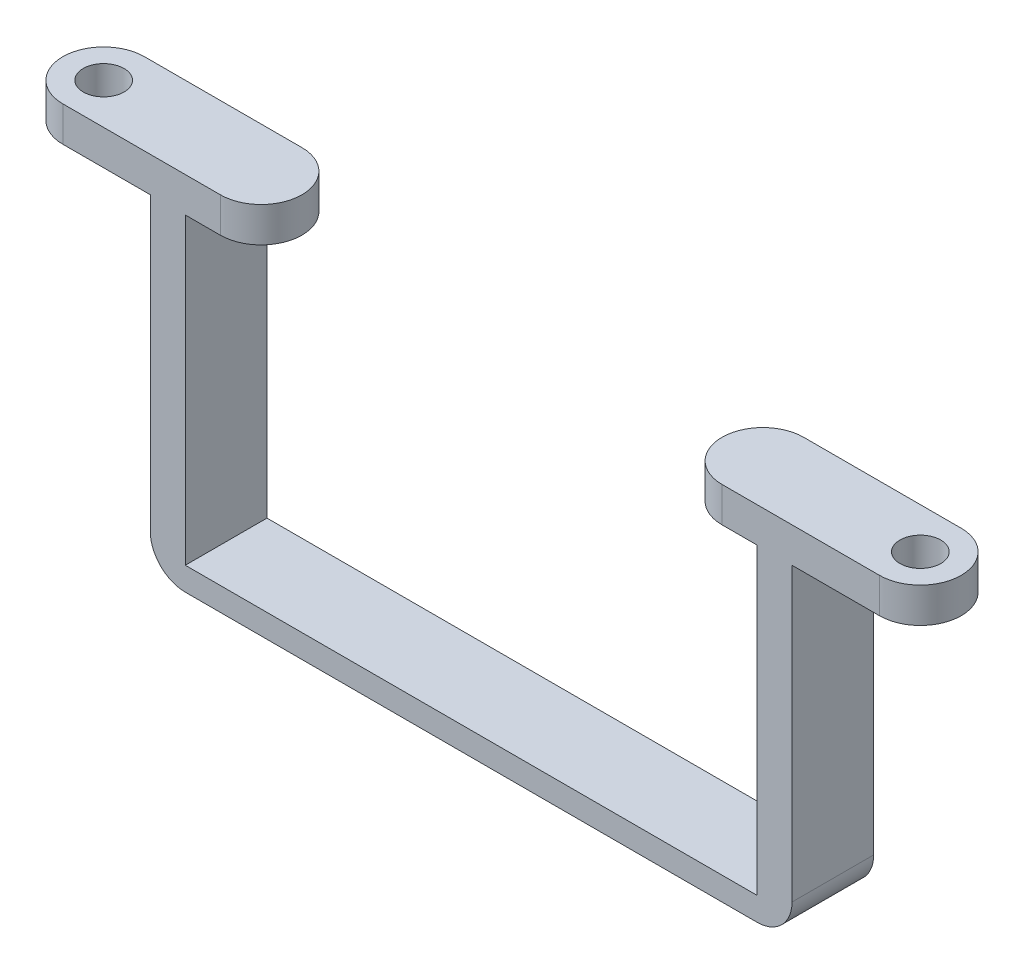
from build123d import *

# Parameters (mm, degrees)
SKETCH1_R           = 1.75
BOSS_EXTRUDE1_DEPTH = 3
SKETCH2_W           = 3
SKETCH2_H           = 7
BOSS_EXTRUDE2_DEPTH = 26
SKETCH3_W           = 27.49999964
SKETCH3_H           = 7
BOSS_EXTRUDE3_DEPTH = 2
FILLET1_R           = 3


with BuildPart() as part:
    # Sketch1 → Boss-Extrude1 (new body)
    with BuildSketch(Plane(origin=(0, 0, 0), x_dir=(1, 0, 0), z_dir=(0, 1, 0))):
        with BuildLine():
            Line((0, 3.5), (10.5, 3.5))
            Line((10.5, 3.5), (13.5, 3.5))
            ThreePointArc((13.5, 3.5), (17, 0), (13.5, -3.5))
            Line((13.5, -3.5), (10.5, -3.5))
            Line((10.5, -3.5), (0, -3.5))
            ThreePointArc((0, -3.5), (-3.5, 0), (0, 3.5))
        make_face()
        with Locations(Location((0, 0, 0), (0, 0, 270))):
            Circle(SKETCH1_R, mode=Mode.SUBTRACT)
    extrude(amount=BOSS_EXTRUDE1_DEPTH)

    # Sketch2 → Boss-Extrude2 (add)
    with BuildSketch(Plane(origin=(0, 0, 0), x_dir=(1, 0, 0), z_dir=(0, 1, 0))):
        with Locations((9, 0)):
            Rectangle(SKETCH2_W, SKETCH2_H)
    extrude(amount=-BOSS_EXTRUDE2_DEPTH)

    # Sketch3 → Boss-Extrude3 (add)
    with BuildSketch(Plane.XZ.offset(26)):
        with Locations((21.24999982, 0)):
            Rectangle(SKETCH3_W, SKETCH3_H)
    extrude(amount=BOSS_EXTRUDE3_DEPTH)

    # Fillet1
    fillet1_edges = [part.edges().sort_by_distance(p)[0] for p in [
        (7.5, -28, 0),
    ]]
    fillet(fillet1_edges, radius=FILLET1_R)

    # Mirror1: part across plane


with BuildPart() as part_1:
    add(part.part)
    add(part.part.mirror(Plane(origin=(34.99999964, -28, -3.5), x_dir=(0, 0, 1), z_dir=(-1, 0, 0))))


solid = part_1.part
